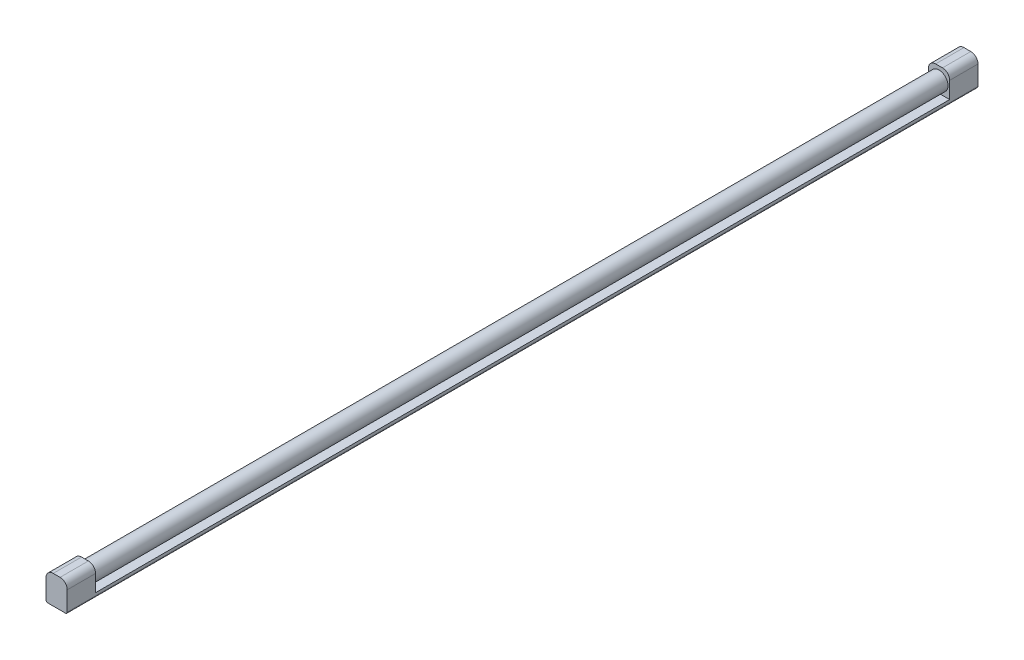
from build123d import *

# Parameters (mm, degrees)
SKETCH1_W           = 30
SKETCH1_H           = 40
BOSS_EXTRUDE1_DEPTH = 40
FILLET1_R           = 10.16
FILLET2_R           = 2.54
SKETCH3_R           = 12.7
BOSS_EXTRUDE2_DEPTH = 1206
SKETCH6_W           = 30
SKETCH6_H           = 40
BOSS_EXTRUDE3_DEPTH = 40.00000001
FILLET3_R           = 10.16
FILLET4_R           = 2.54
SKETCH7_W           = 30
SKETCH7_H           = 6.35
BOSS_EXTRUDE4_DEPTH = 1206
FILLET5_R           = 2.54


with BuildPart() as part:
    # Sketch1 → Boss-Extrude1 (new body)
    with BuildSketch(Plane.XY):
        with Locations((15, 20)):
            Rectangle(SKETCH1_W, SKETCH1_H)
    extrude(amount=BOSS_EXTRUDE1_DEPTH)

    # Fillet1
    fillet1_edges = [part.edges().sort_by_distance(p)[0] for p in [
        (0, 40, 20),
        (30, 40, 20),
    ]]
    fillet(fillet1_edges, radius=FILLET1_R)

    # Fillet2
    fillet2_edges = [part.edges().sort_by_distance(p)[0] for p in [
        (30, 0, 20),
        (0, 0, 20),
    ]]
    fillet(fillet2_edges, radius=FILLET2_R)

    # Sketch3 → Boss-Extrude2 (add)
    with BuildSketch(Plane.XY.offset(40)):
        with Locations((15, 22.22)):
            Circle(SKETCH3_R)
    extrude(amount=BOSS_EXTRUDE2_DEPTH)

    # Sketch6 → Boss-Extrude3 (add)
    with BuildSketch(Plane.XY.offset(1246)):
        with Locations((15, 20)):
            Rectangle(SKETCH6_W, SKETCH6_H)
    extrude(amount=BOSS_EXTRUDE3_DEPTH)

    # Fillet3
    fillet3_edges = [part.edges().sort_by_distance(p)[0] for p in [
        (0, 40, 1266.000000005),
        (30, 40, 1266.000000005),
    ]]
    fillet(fillet3_edges, radius=FILLET3_R)

    # Fillet4
    fillet4_edges = [part.edges().sort_by_distance(p)[0] for p in [
        (0, 0, 1266.000000005),
        (30, 0, 1266.000000005),
    ]]
    fillet(fillet4_edges, radius=FILLET4_R)

    # Sketch7 → Boss-Extrude4 (add)
    with BuildSketch(Plane.XY.offset(40)):
        with Locations((15, 3.175)):
            Rectangle(SKETCH7_W, SKETCH7_H)
    extrude(amount=BOSS_EXTRUDE4_DEPTH)

    # Fillet5
    fillet5_edges = [part.edges().sort_by_distance(p)[0] for p in [
        (30, 0, 643),
        (0, 0, 643),
    ]]
    fillet(fillet5_edges, radius=FILLET5_R)


solid = part.part
